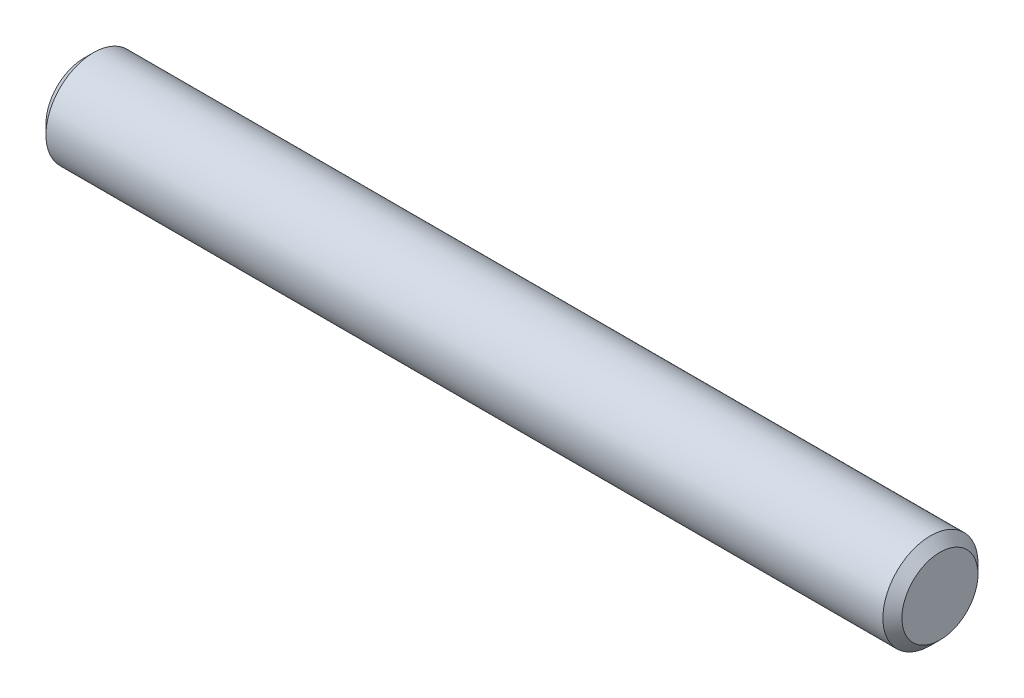
from build123d import *

# Parameters (mm, degrees)
EXTRUDE1_DEPTH      = 14.2875
EXTRUDE1_DEPTH_BACK = 14.2875
SKETCH2_R           = 1.5875
CHAMFER1_SIZE       = 0.3175


with BuildPart() as part:
    # Sketch2 → Extrude1 (new, two sides: drawn at the far end of the back side and taken through both)
    with BuildSketch(Plane(origin=(0, 0, 0), x_dir=(0, 0, -1), z_dir=(1, 0, 0)).offset(-EXTRUDE1_DEPTH_BACK)):
        Circle(SKETCH2_R)
    extrude(amount=EXTRUDE1_DEPTH + EXTRUDE1_DEPTH_BACK)

    # Chamfer1
    chamfer1_edges = [part.edges().sort_by_distance(p)[0] for p in [
        (-14.2875, 0, 1.5875),
        (14.2875, 0, 1.5875),
    ]]
    chamfer(chamfer1_edges, length=CHAMFER1_SIZE)


solid = part.part
